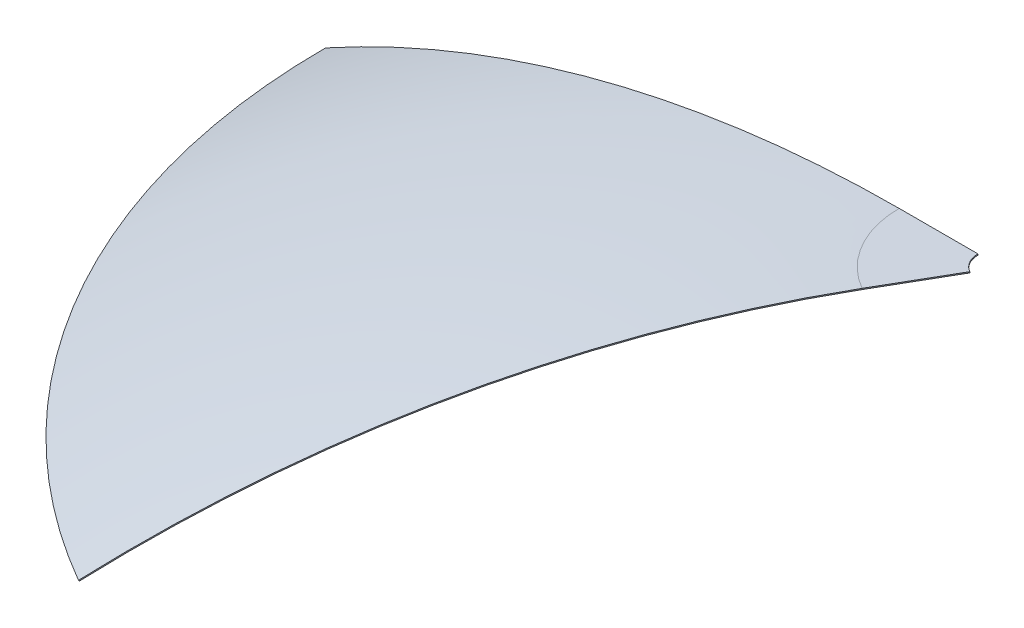
from build123d import *

# Parameters (mm, degrees)
REVOLVE1_ANGLE = 60


with BuildPart() as part:
    # Sketch1 → Revolve1 (revolve)
    with BuildSketch(Plane.XY):
        with BuildLine():
            Line((-45, 1.936673673), (-10, 1.936673673))
            Line((-10, 1.936673673), (-10, 2.436673673))
            Line((-10, 2.436673673), (-45.000375853, 2.436673673))
            ThreePointArc((-45.000375853, 2.436673673), (-45.557674224, 2.435543108), (-46.114971099, 2.433826721))
            ThreePointArc((-46.114971099, 2.433826721), (-177.046295247, -14.475660779), (-299.740246695, -63.211034879))
            Line((-299.740246695, -63.211034879), (-299.499248826, -63.64912166))
            ThreePointArc((-299.499248826, -63.64912166), (-176.921010606, -14.959710114), (-46.11316839, 1.933829971))
            ThreePointArc((-46.11316839, 1.933829971), (-45.556584942, 1.935544259), (-45, 1.936673673))
        make_face()
    revolve(axis=Axis((0, -998.5, 0), (0, 1, 0)), revolution_arc=REVOLVE1_ANGLE)


solid = part.part
